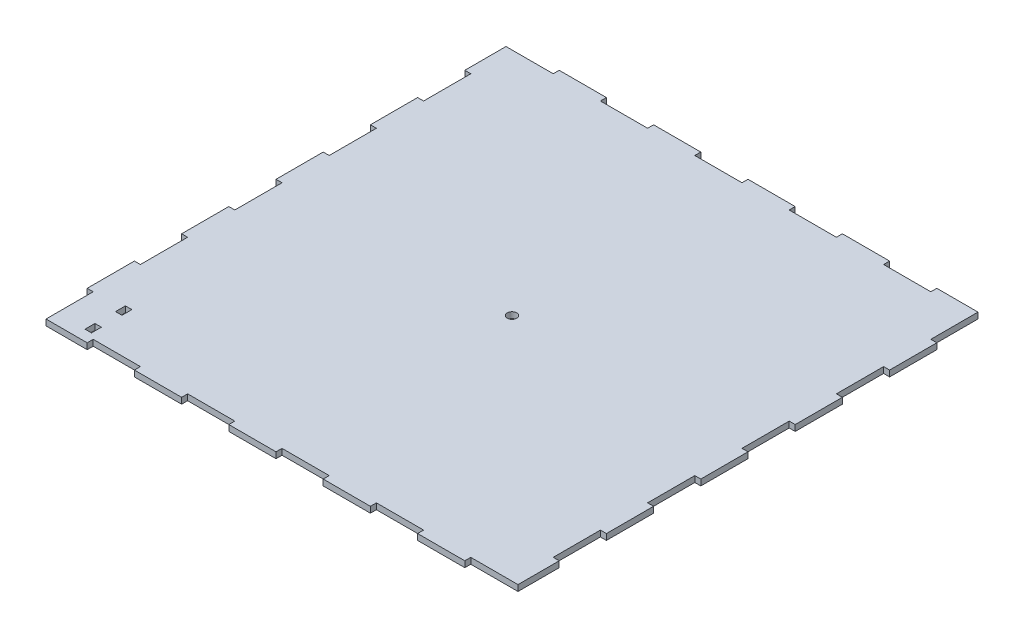
from build123d import *

# Parameters (mm, degrees)
SKETCH1_W                    = 500
SKETCH1_H                    = 500
BOSS_EXTRUDE1_DEPTH          = 3.175
SKETCH2_W                    = 50
SKETCH2_H                    = 6.35
CUT_EXTRUDE1_DEPTH           = 354.610410622
LPATTERN1_COUNT              = 5
LPATTERN1_PITCH              = 100
SKETCH3_R                    = 5
CUT_EXTRUDE2_DEPTH           = 354.610410622
CIRPATTERN1_COUNT            = 4
CIRPATTERN1_COPY_1_SKETCH_W  = 50
CIRPATTERN1_COPY_1_SKETCH_H  = 6.35
CIRPATTERN1_COPY_1_DEPTH     = 354.610410622
CIRPATTERN1_COPY_2_SKETCH_W  = 50
CIRPATTERN1_COPY_2_SKETCH_H  = 6.35
CIRPATTERN1_COPY_2_DEPTH     = 354.610410622
CIRPATTERN1_COPY_3_SKETCH_W  = 50
CIRPATTERN1_COPY_3_SKETCH_H  = 6.35
CIRPATTERN1_COPY_3_DEPTH     = 354.610410622
CIRPATTERN1_COPY_4_SKETCH_W  = 50
CIRPATTERN1_COPY_4_SKETCH_H  = 6.35
CIRPATTERN1_COPY_4_DEPTH     = 354.610410622
CIRPATTERN1_COPY_5_SKETCH_W  = 50
CIRPATTERN1_COPY_5_SKETCH_H  = 6.35
CIRPATTERN1_COPY_5_DEPTH     = 354.610410622
CIRPATTERN1_COPY_6_SKETCH_W  = 50
CIRPATTERN1_COPY_6_SKETCH_H  = 6.35
CIRPATTERN1_COPY_6_DEPTH     = 354.610410622
CIRPATTERN1_COPY_7_SKETCH_W  = 50
CIRPATTERN1_COPY_7_SKETCH_H  = 6.35
CIRPATTERN1_COPY_7_DEPTH     = 354.610410622
CIRPATTERN1_COPY_8_SKETCH_W  = 50
CIRPATTERN1_COPY_8_SKETCH_H  = 6.35
CIRPATTERN1_COPY_8_DEPTH     = 354.610410622
CIRPATTERN1_COPY_9_SKETCH_W  = 50
CIRPATTERN1_COPY_9_SKETCH_H  = 6.35
CIRPATTERN1_COPY_9_DEPTH     = 354.610410622
CIRPATTERN1_COPY_10_SKETCH_W = 50
CIRPATTERN1_COPY_10_SKETCH_H = 6.35
CIRPATTERN1_COPY_10_DEPTH    = 354.610410622
CIRPATTERN1_COPY_11_SKETCH_W = 50
CIRPATTERN1_COPY_11_SKETCH_H = 6.35
CIRPATTERN1_COPY_11_DEPTH    = 354.610410622
CIRPATTERN1_COPY_12_SKETCH_W = 50
CIRPATTERN1_COPY_12_SKETCH_H = 6.35
CIRPATTERN1_COPY_12_DEPTH    = 354.610410622
SKETCH5_W                    = 6.85
SKETCH5_H                    = 10.5
CUT_EXTRUDE3_DEPTH           = 354.610410622


with BuildPart() as part:
    # Sketch1 → Boss-Extrude1 (new, symmetric)
    with BuildSketch(Plane(origin=(0, 0, 0), x_dir=(1, 0, 0), z_dir=(0, 1, 0))):
        Rectangle(SKETCH1_W, SKETCH1_H)
    extrude(amount=BOSS_EXTRUDE1_DEPTH, both=True)

    # Sketch2 → Cut-Extrude1 (cut, through all)
    with BuildSketch(Plane(origin=(0, 3.175, 0), x_dir=(1, 0, 0), z_dir=(0, 1, 0))):
        with Locations((-225, 246.825)):
            Rectangle(SKETCH2_W, SKETCH2_H)
    cut_extrude1 = extrude(amount=-CUT_EXTRUDE1_DEPTH, mode=Mode.SUBTRACT)

    # LPattern1: Cut-Extrude1 ×5
    with Locations(*[(i * LPATTERN1_PITCH, 0, 0) for i in range(1, LPATTERN1_COUNT)]):
        add(cut_extrude1, mode=Mode.SUBTRACT)

    # Sketch3 → Cut-Extrude2 (cut, through all)
    with BuildSketch(Plane(origin=(0, 3.175, 0), x_dir=(1, 0, 0), z_dir=(0, 1, 0))):
        with Locations(Location((0, 0, 0), (0, 0, 270))):
            Circle(SKETCH3_R)
    extrude(amount=-CUT_EXTRUDE2_DEPTH, mode=Mode.SUBTRACT)

    # CirPattern1: Cut-Extrude1 ×4 about axis
    cirpattern1_axis = Axis((0, 0, 0), (0, 1, 0))
    for i in range(1, CIRPATTERN1_COUNT):
        add(cut_extrude1.rotate(cirpattern1_axis, i * 360 / CIRPATTERN1_COUNT), mode=Mode.SUBTRACT)

    # CirPattern1 copy 1 sketch → CirPattern1 copy 1 (cut, through all)
    with BuildSketch(Plane(origin=(0, 3.175, -100), x_dir=(0, 0, -1), z_dir=(0, 1, 0))):
        with Locations((-225, 246.825)):
            Rectangle(CIRPATTERN1_COPY_1_SKETCH_W, CIRPATTERN1_COPY_1_SKETCH_H)
    extrude(amount=-CIRPATTERN1_COPY_1_DEPTH, mode=Mode.SUBTRACT)

    # CirPattern1 copy 2 sketch → CirPattern1 copy 2 (cut, through all)
    with BuildSketch(Plane(origin=(-100, 3.175, 0), x_dir=(-1, 0, 0), z_dir=(0, 1, 0))):
        with Locations((-225, 246.825)):
            Rectangle(CIRPATTERN1_COPY_2_SKETCH_W, CIRPATTERN1_COPY_2_SKETCH_H)
    extrude(amount=-CIRPATTERN1_COPY_2_DEPTH, mode=Mode.SUBTRACT)

    # CirPattern1 copy 3 sketch → CirPattern1 copy 3 (cut, through all)
    with BuildSketch(Plane(origin=(0, 3.175, 100), x_dir=(0, 0, 1), z_dir=(0, 1, 0))):
        with Locations((-225, 246.825)):
            Rectangle(CIRPATTERN1_COPY_3_SKETCH_W, CIRPATTERN1_COPY_3_SKETCH_H)
    extrude(amount=-CIRPATTERN1_COPY_3_DEPTH, mode=Mode.SUBTRACT)

    # CirPattern1 copy 4 sketch → CirPattern1 copy 4 (cut, through all)
    with BuildSketch(Plane(origin=(0, 3.175, -200), x_dir=(0, 0, -1), z_dir=(0, 1, 0))):
        with Locations((-225, 246.825)):
            Rectangle(CIRPATTERN1_COPY_4_SKETCH_W, CIRPATTERN1_COPY_4_SKETCH_H)
    extrude(amount=-CIRPATTERN1_COPY_4_DEPTH, mode=Mode.SUBTRACT)

    # CirPattern1 copy 5 sketch → CirPattern1 copy 5 (cut, through all)
    with BuildSketch(Plane(origin=(-200, 3.175, 0), x_dir=(-1, 0, 0), z_dir=(0, 1, 0))):
        with Locations((-225, 246.825)):
            Rectangle(CIRPATTERN1_COPY_5_SKETCH_W, CIRPATTERN1_COPY_5_SKETCH_H)
    extrude(amount=-CIRPATTERN1_COPY_5_DEPTH, mode=Mode.SUBTRACT)

    # CirPattern1 copy 6 sketch → CirPattern1 copy 6 (cut, through all)
    with BuildSketch(Plane(origin=(0, 3.175, 200), x_dir=(0, 0, 1), z_dir=(0, 1, 0))):
        with Locations((-225, 246.825)):
            Rectangle(CIRPATTERN1_COPY_6_SKETCH_W, CIRPATTERN1_COPY_6_SKETCH_H)
    extrude(amount=-CIRPATTERN1_COPY_6_DEPTH, mode=Mode.SUBTRACT)

    # CirPattern1 copy 7 sketch → CirPattern1 copy 7 (cut, through all)
    with BuildSketch(Plane(origin=(0, 3.175, -300), x_dir=(0, 0, -1), z_dir=(0, 1, 0))):
        with Locations((-225, 246.825)):
            Rectangle(CIRPATTERN1_COPY_7_SKETCH_W, CIRPATTERN1_COPY_7_SKETCH_H)
    extrude(amount=-CIRPATTERN1_COPY_7_DEPTH, mode=Mode.SUBTRACT)

    # CirPattern1 copy 8 sketch → CirPattern1 copy 8 (cut, through all)
    with BuildSketch(Plane(origin=(-300, 3.175, 0), x_dir=(-1, 0, 0), z_dir=(0, 1, 0))):
        with Locations((-225, 246.825)):
            Rectangle(CIRPATTERN1_COPY_8_SKETCH_W, CIRPATTERN1_COPY_8_SKETCH_H)
    extrude(amount=-CIRPATTERN1_COPY_8_DEPTH, mode=Mode.SUBTRACT)

    # CirPattern1 copy 9 sketch → CirPattern1 copy 9 (cut, through all)
    with BuildSketch(Plane(origin=(0, 3.175, 300), x_dir=(0, 0, 1), z_dir=(0, 1, 0))):
        with Locations((-225, 246.825)):
            Rectangle(CIRPATTERN1_COPY_9_SKETCH_W, CIRPATTERN1_COPY_9_SKETCH_H)
    extrude(amount=-CIRPATTERN1_COPY_9_DEPTH, mode=Mode.SUBTRACT)

    # CirPattern1 copy 10 sketch → CirPattern1 copy 10 (cut, through all)
    with BuildSketch(Plane(origin=(0, 3.175, -400), x_dir=(0, 0, -1), z_dir=(0, 1, 0))):
        with Locations((-225, 246.825)):
            Rectangle(CIRPATTERN1_COPY_10_SKETCH_W, CIRPATTERN1_COPY_10_SKETCH_H)
    extrude(amount=-CIRPATTERN1_COPY_10_DEPTH, mode=Mode.SUBTRACT)

    # CirPattern1 copy 11 sketch → CirPattern1 copy 11 (cut, through all)
    with BuildSketch(Plane(origin=(-400, 3.175, 0), x_dir=(-1, 0, 0), z_dir=(0, 1, 0))):
        with Locations((-225, 246.825)):
            Rectangle(CIRPATTERN1_COPY_11_SKETCH_W, CIRPATTERN1_COPY_11_SKETCH_H)
    extrude(amount=-CIRPATTERN1_COPY_11_DEPTH, mode=Mode.SUBTRACT)

    # CirPattern1 copy 12 sketch → CirPattern1 copy 12 (cut, through all)
    with BuildSketch(Plane(origin=(0, 3.175, 400), x_dir=(0, 0, 1), z_dir=(0, 1, 0))):
        with Locations((-225, 246.825)):
            Rectangle(CIRPATTERN1_COPY_12_SKETCH_W, CIRPATTERN1_COPY_12_SKETCH_H)
    extrude(amount=-CIRPATTERN1_COPY_12_DEPTH, mode=Mode.SUBTRACT)

    # Sketch5 → Cut-Extrude3 (cut, through all)
    with BuildSketch(Plane(origin=(0, 3.175, 0), x_dir=(1, 0, 0), z_dir=(0, 1, 0))):
        with Locations((-210.225, -201.1)):
            Rectangle(SKETCH5_W, SKETCH5_H)
        with Locations((-210.225, -233.4)):
            Rectangle(SKETCH5_W, SKETCH5_H)
    extrude(amount=-CUT_EXTRUDE3_DEPTH, mode=Mode.SUBTRACT)


solid = part.part
